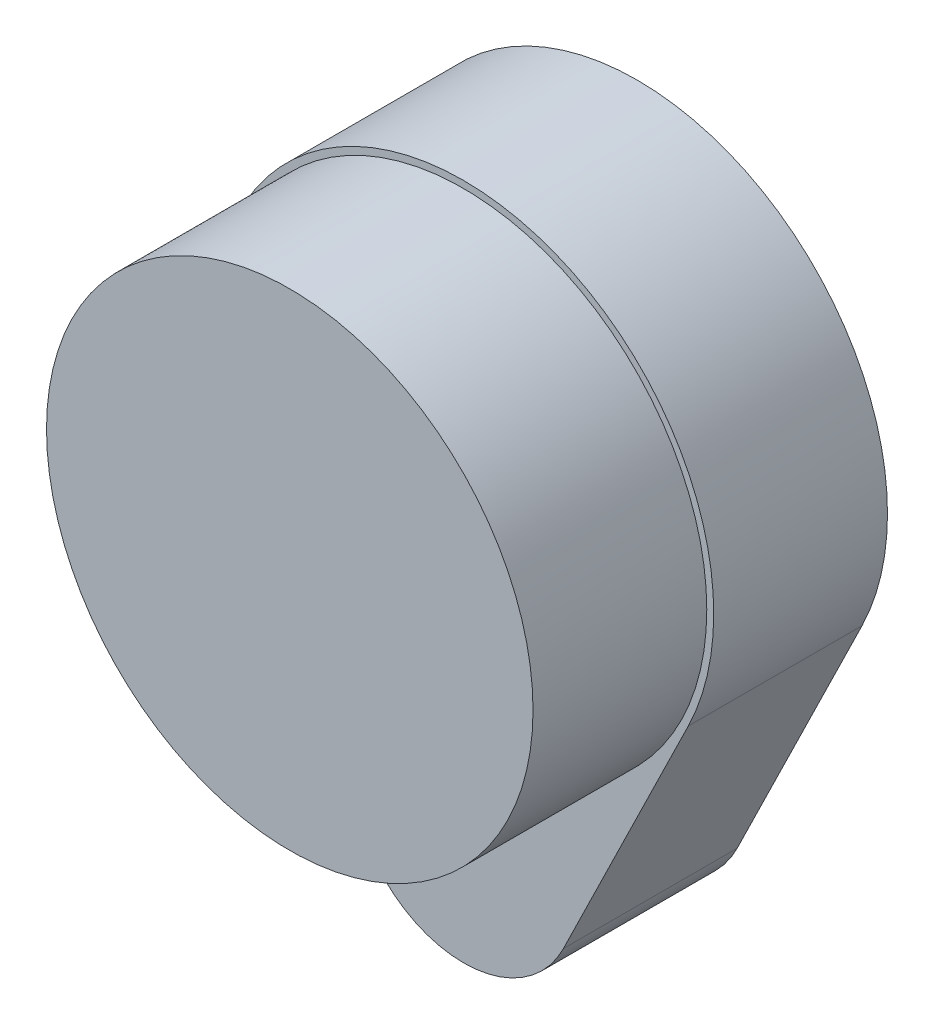
from build123d import *

# Parameters (mm, degrees)
EXTRUDE_1_DEPTH           = 25
SKETCH_2_R                = 35
EXTRUDE_2_DEPTH           = 25
HOLE_WIZARD_3_0_3_1_D     = 3
HOLE_WIZARD_3_0_3_1_DEPTH = 5


with BuildPart() as part:
    # 草图1 → 凸台-拉伸1 (new body)
    with BuildSketch(Plane.XY.offset(20)):
        with BuildLine():
            Line((14.371408237, -44.032967033), (32.335668533, -7.324175824))
            ThreePointArc((32.335668533, -7.324175824), (0, 44.5), (-32.335668533, -7.324175824))
            Line((-32.335668533, -7.324175824), (-14.371408237, -44.032967033))
            ThreePointArc((-14.371408237, -44.032967033), (0, -53), (14.371408237, -44.032967033))
        make_face()
    extrude(amount=-EXTRUDE_1_DEPTH)

    # 草图2 → 凸台-拉伸2 (add)
    with BuildSketch(Plane(origin=(0, 0, 20), x_dir=(-1, 0, 0), z_dir=(0, 0, -1))):
        with Locations(Location((0, 8.5, 0), (0, 0, 180))):
            Circle(SKETCH_2_R)
    extrude(amount=-EXTRUDE_2_DEPTH)

    # Ø3.0 (3) 直径孔1
    with Locations(Plane(origin=(0, 0, -5), x_dir=(-1, 0, 0), z_dir=(0, 0, -1))):
        with Locations((0, 0), (0, -37)):
            Hole(HOLE_WIZARD_3_0_3_1_D / 2, depth=HOLE_WIZARD_3_0_3_1_DEPTH)


solid = part.part
